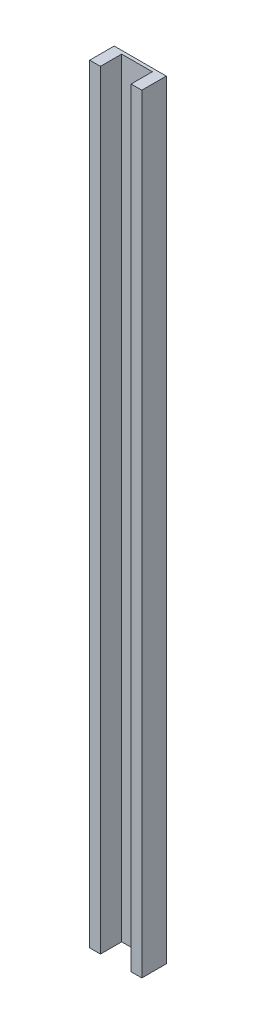
from build123d import *

# Parameters (mm, degrees)
BOSS_EXTRUDE1_DEPTH = 251


with BuildPart() as part:
    # Sketch1 → Boss-Extrude1 (new body)
    with BuildSketch(Plane(origin=(0, 0, 0), x_dir=(1, 0, 0), z_dir=(0, 1, 0))):
        Polygon((-5, -4), (-5, 2.938756375), (5, 2.938756375), (5, -4), (8.5, -4), (8.5, 4), (-8.5, 4), (-8.5, -4), align=None)
    extrude(amount=BOSS_EXTRUDE1_DEPTH)


solid = part.part
